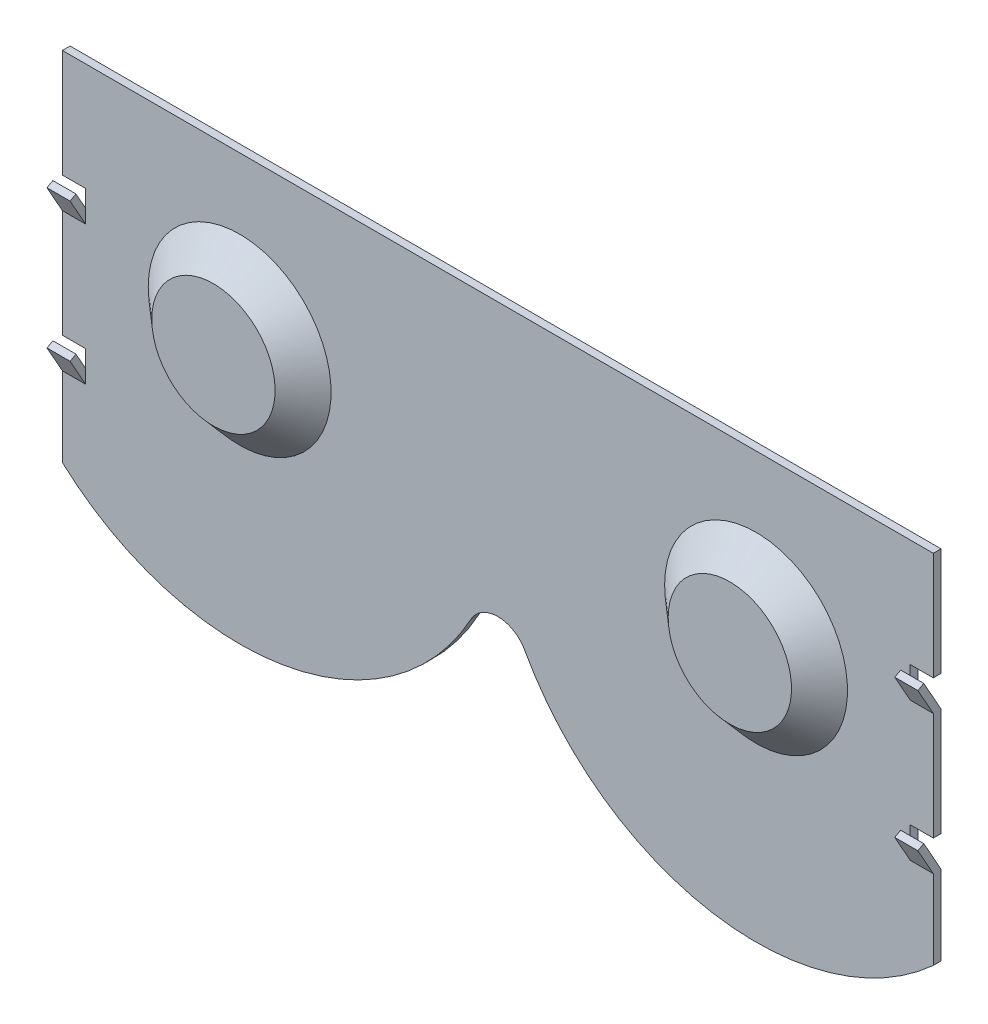
from build123d import *

# Parameters (mm, degrees)
BOSS_EXTRU_1_DEPTH = 0.5
BOSS_EXTRU_2_DEPTH = 1.5
BOSS_EXTRU_3_START = -55
BOSS_EXTRU_3_DEPTH = 1.5


with BuildPart() as part:
    # Esquisse1 → Boss.-Extru.1 (new body)
    with BuildSketch(Plane.XY):
        with BuildLine():
            Line((-28.25, 0), (28.25, 0))
            Line((28.25, 0), (28.25, -7))
            Line((28.25, -7), (26.75, -7))
            Line((26.75, -7), (26.75, -9))
            Line((26.75, -9), (28.25, -9))
            Line((28.25, -9), (28.25, -16))
            Line((28.25, -16), (26.75, -16))
            Line((26.75, -16), (26.75, -18))
            Line((26.75, -18), (28.25, -18))
            Line((28.25, -18), (28.25, -23.155433616))
            ThreePointArc((28.25, -23.155433616), (13.925220168, -27.365070972), (1.753926702, -18.717529168))
            ThreePointArc((1.753926702, -18.717529168), (0, -17.678643691), (-1.753926702, -18.717529168))
            ThreePointArc((-1.753926702, -18.717529168), (-13.925220168, -27.365070972), (-28.25, -23.155433616))
            Line((-28.25, -23.155433616), (-28.25, -18))
            Line((-28.25, -18), (-26.75, -18))
            Line((-26.75, -18), (-26.75, -16))
            Line((-26.75, -16), (-28.25, -16))
            Line((-28.25, -16), (-28.25, -9))
            Line((-28.25, -9), (-26.75, -9))
            Line((-26.75, -9), (-26.75, -7))
            Line((-26.75, -7), (-28.25, -7))
            Line((-28.25, -7), (-28.25, 0))
        make_face()
    extrude(amount=BOSS_EXTRU_1_DEPTH)

    # Esquisse2 → Révolution1 (revolve)
    with BuildSketch(Plane.XZ.offset(10.5), mode=Mode.PRIVATE) as r_volution1_sk:
        Polygon((-16.75, 0), (-16.75, 2.2), (-12.75, 2.2), (-10.25, 0), align=None)
    revolve(r_volution1_sk.sketch.rotate(Axis((-16.75, -10.5, 0), (0, 0, 1)), 180), axis=Axis((-16.75, -10.5, 0), (0, 0, 1)))

    # Esquisse3 → Révolution2 (revolve)
    with BuildSketch(Plane.XZ.offset(10.5), mode=Mode.PRIVATE) as r_volution2_sk:
        Polygon((16.75, 0), (16.75, 2.2), (20.75, 2.2), (23.25, 0), align=None)
    revolve(r_volution2_sk.sketch.rotate(Axis((16.75, -10.5, 0), (0, 0, 1)), 180), axis=Axis((16.75, -10.5, 0), (0, 0, 1)))

    # Esquisse5 → Boss.-Extru.2 (add)
    with BuildSketch(Plane(origin=(28.25, 0, 0), x_dir=(0, 0, -1), z_dir=(1, 0, 0))):
        Polygon((0, -18), (-1.119243945, -16), (-1.5, -16.213079455), (-0.5, -18), align=None)
        Polygon((-0.5, -9), (-1.5, -7.213079455), (-1.119243945, -7), (0, -9), align=None)
    extrude(amount=-BOSS_EXTRU_2_DEPTH)

    # Esquisse5<2> → Boss.-Extru.3 (add)
    with BuildSketch(Plane(origin=(28.25, 0, 0), x_dir=(0, 0, -1), z_dir=(1, 0, 0)).offset(BOSS_EXTRU_3_START)):
        Polygon((0, -18), (-1.119243945, -16), (-1.5, -16.213079455), (-0.5, -18), align=None)
        Polygon((-0.5, -9), (-1.5, -7.213079455), (-1.119243945, -7), (0, -9), align=None)
    extrude(amount=-BOSS_EXTRU_3_DEPTH)


solid = part.part
